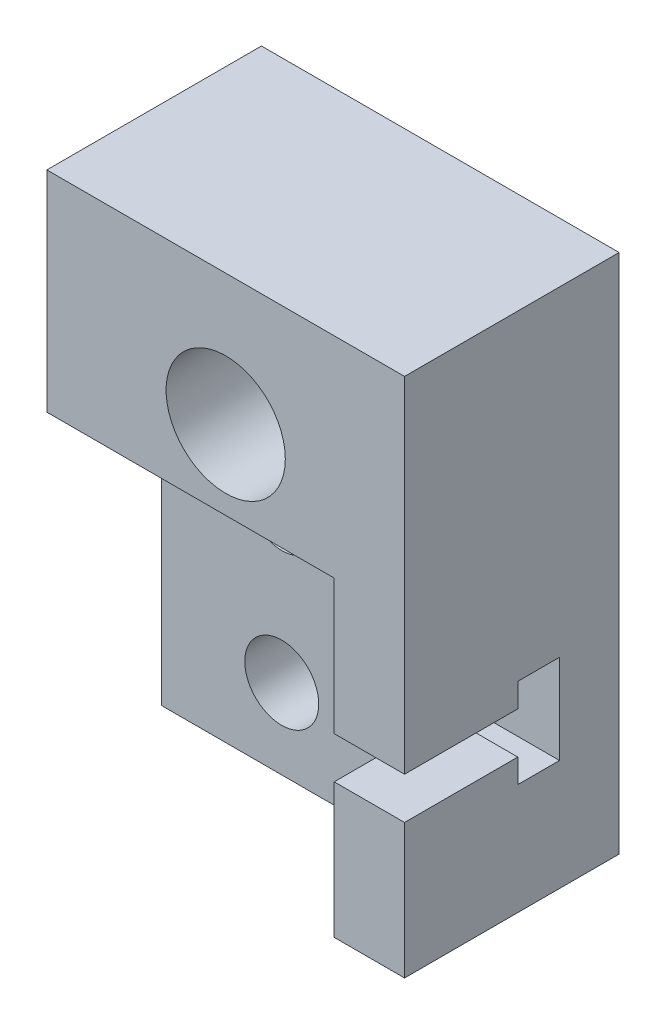
from build123d import *

# Parameters (mm, degrees)
PROFILESKETCH3_W                           = 15
PROFILESKETCH3_H                           = 21.85
PROFILEBOSS_EXTRUDE1_DEPTH                 = 9
MICROSWITCHCUTSKETCH4_W                    = 12.05
MICROSWITCHCUTSKETCH4_H                    = 13.05
MICROSWITCHCUT_EXTRUDE1_DEPTH              = 4.8
SKETCH5_R                                  = 1.55
MICROSWITCHMOUNTINGHOLESCUT_EXTRUDE2_DEPTH = 3.1
SMALLCHANNELCABLESKETCH6_W                 = 2.95
SMALLCHANNELCABLESKETCH6_H                 = 1.75
SMALLCHANNELCABLECUT_EXTRUDE3_DEPTH        = 4.75
LARGECHANNELCABLESKETCH7_W                 = 2.95
LARGECHANNELCABLESKETCH7_H                 = 3.75
LARGECHANNELCABLECUT_EXTRUDE4_DEPTH        = 1.75
CHAMFER1_SIZE                              = 1
SKETCH6_R                                  = 2.5
MICROSWITCHMOUNTINGHOLECUT_EXTRUDE1_DEPTH  = 28.9896856


with BuildPart() as part:
    # ProfileSketch3 → ProfileBoss-Extrude1 (new body)
    with BuildSketch(Plane.XY):
        with Locations((7.5, 10.925)):
            Rectangle(PROFILESKETCH3_W, PROFILESKETCH3_H)
    extrude(amount=PROFILEBOSS_EXTRUDE1_DEPTH)

    # MicroSwitchCutSketch4 → MicroSwitchCut-Extrude1 (cut)
    with BuildSketch(Plane.XY.offset(9)):
        with Locations((6.025, 6.525)):
            Rectangle(MICROSWITCHCUTSKETCH4_W, MICROSWITCHCUTSKETCH4_H)
    extrude(amount=-MICROSWITCHCUT_EXTRUDE1_DEPTH, mode=Mode.SUBTRACT)

    # Sketch5 → MicroSwitchMountingHolesCut-Extrude2 (cut)
    with BuildSketch(Plane.XY.offset(4.2)):
        with Locations((5.05, 9.7)):
            Circle(SKETCH5_R)
        with Locations((5.05, 3.35)):
            Circle(SKETCH5_R)
    extrude(amount=-MICROSWITCHMOUNTINGHOLESCUT_EXTRUDE2_DEPTH, mode=Mode.SUBTRACT)

    # SmallChannelCableSketch6 → SmallChannelCableCut-Extrude3 (cut)
    with BuildSketch(Plane.XY.offset(9)):
        with Locations((13.525, 6.525)):
            Rectangle(SMALLCHANNELCABLESKETCH6_W, SMALLCHANNELCABLESKETCH6_H)
    extrude(amount=-SMALLCHANNELCABLECUT_EXTRUDE3_DEPTH, mode=Mode.SUBTRACT)

    # LargeChannelCableSketch7 → LargeChannelCableCut-Extrude4 (cut)
    with BuildSketch(Plane.XY.offset(4.25)):
        with Locations((13.525, 6.525)):
            Rectangle(LARGECHANNELCABLESKETCH7_W, LARGECHANNELCABLESKETCH7_H)
    extrude(amount=-LARGECHANNELCABLECUT_EXTRUDE4_DEPTH, mode=Mode.SUBTRACT)

    # Chamfer1
    chamfer1_edges = [part.edges().sort_by_distance(p)[0] for p in [
        (12.05, 6.525, 4.2),
    ]]
    chamfer(chamfer1_edges, length=CHAMFER1_SIZE)

    # Sketch6 → MicroSwitchMountingHoleCut-Extrude1 (cut, through all)
    with BuildSketch(Plane.XY.offset(9)):
        with Locations((7.5, 16.35)):
            Circle(SKETCH6_R)
    extrude(amount=-MICROSWITCHMOUNTINGHOLECUT_EXTRUDE1_DEPTH, mode=Mode.SUBTRACT)


solid = part.part
